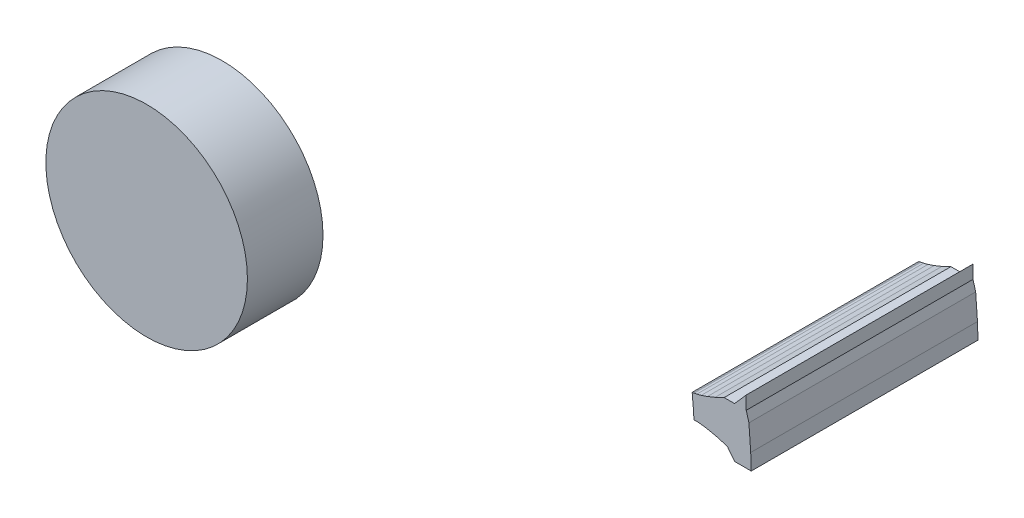
from build123d import *

# Parameters (mm, degrees)
SKETCH_1_R          = 8
EXTRUDE_1_DEPTH     = 24
SKETCH_2_R          = 42
EXTRUDE_2_DEPTH     = 18
SKETCH_3_OUTSIDE_W  = 110.238
SKETCH_3_OUTSIDE_H  = 110.238
CUT_EXTRUDE_1_DEPTH = 63.064482597


with BuildPart() as part:
    # 草图1 → 凸台-拉伸1 (new body)
    with BuildSketch(Plane.XY):
        Circle(SKETCH_1_R)
    extrude(amount=EXTRUDE_1_DEPTH)

    # 草图2 → 凸台-拉伸2 (add)
    with BuildSketch(Plane.XY):
        Circle(SKETCH_2_R)
    extrude(amount=EXTRUDE_2_DEPTH)

    # 草图3 outside → 切除-拉伸1 (cut, through all)
    with BuildSketch(Plane.XY.offset(18)):
        Rectangle(SKETCH_3_OUTSIDE_W, SKETCH_3_OUTSIDE_H)
        Polygon((37.301622014, 3.852141632), (37.388858074, 3.861150507), (37.461006221, 3.871643974), (37.675366655, 3.915051723), (38.027566914, 4.009008778), (38.511598579, 4.17069916), (39.119858589, 4.416721181), (39.843200936, 4.762956257), (40.670998458, 4.762956257), (41.595385312, 5.815833623), (41.595385312, 4.762956257), (41.808227045, 4.009008778), (41.950388094, 2.040818158), (41.992672187, 0.784526971), (40.670998458, 0.784526971), (40.097755581, 1.528532152), (39.329155687, 1.757348851), (38.689898048, 1.905189124), (38.18653167, 1.989169611), (37.823969461, 2.026873652), (37.605457691, 2.036213627), (37.532556268, 2.035291448), (37.44498493, 2.030542685), (37.417469201, 2.486563607), (37.384400063, 2.942215479), align=None, mode=Mode.SUBTRACT)
    extrude(amount=-CUT_EXTRUDE_1_DEPTH, mode=Mode.SUBTRACT)


with BuildPart() as cut_extrude_1_piece_1:
    # of the separate pieces the step leaves, piece 1, a body of its own (cut_extrude_1_pieces)
    add(part.part.solids().sort_by_distance((8, 0, 18))[0])


with BuildPart() as cut_extrude_1_piece_2:
    # of the separate pieces the step leaves, piece 2, a body of its own (cut_extrude_1_pieces)
    add(part.part.solids().sort_by_distance((41.992672187, 0.784526971, 0))[0])


solid = Compound([cut_extrude_1_piece_1.part, cut_extrude_1_piece_2.part])
